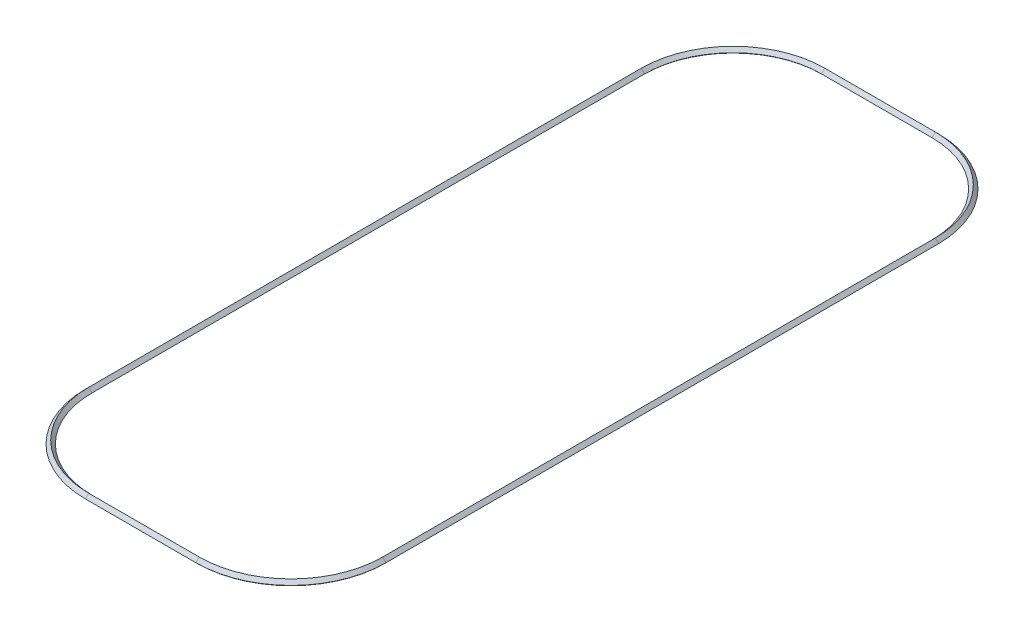
from build123d import *


with BuildPart() as part:
    # Varredura1: sweep along a path in Esboço2
    with BuildLine(Plane(origin=(0, 0, 0), x_dir=(1, 0, 0), z_dir=(0, 1, 0))) as varredura1_path:
        Line((0, -750), (0, 750))
        ThreePointArc((0, 750), (72.930411485, 926.069588515), (249, 999))
        Line((249, 999), (549, 999))
        ThreePointArc((549, 999), (725.069588515, 926.069588515), (798, 750))
        Line((798, 750), (798, -750))
        ThreePointArc((798, -750), (725.069588515, -926.069588515), (549, -999))
        Line((549, -999), (249, -999))
        ThreePointArc((249, -999), (72.930411485, -926.069588515), (0, -750))
    # Esboço1 → Varredura1 (sweep)
    with BuildSketch(Plane.XY):
        Polygon((0, 11.228855685), (8.980256121, 2.248599564), (6.731656557, 0), (0, 6.731656557), (-6.731656557, 0), (-8.980256121, 2.248599564), align=None)
    sweep(path=varredura1_path.line)


solid = part.part
